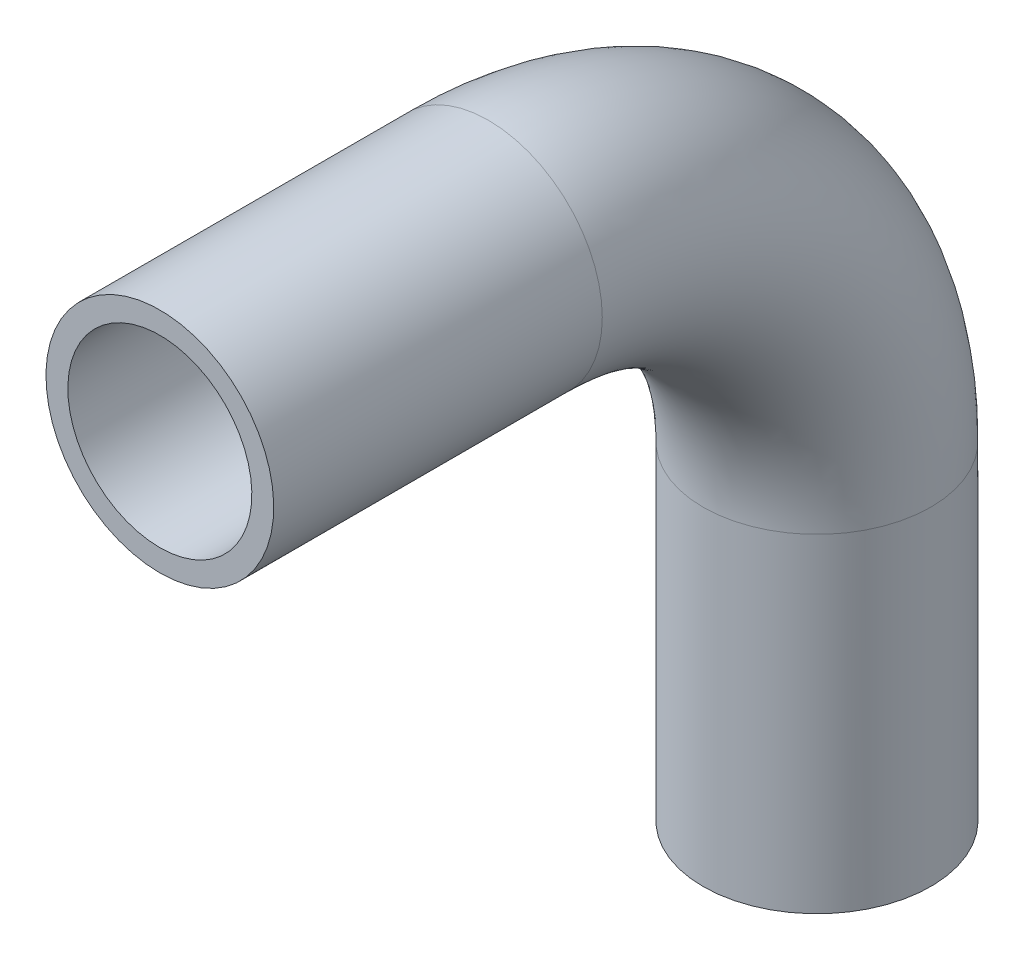
from build123d import *

# Parameters (mm, degrees)
SKETCH2_R   = 6.604
SKETCH2_R_2 = 5.334


with BuildPart() as part:
    # Sweep-Thin1: sweep along a path in Sketch1
    with BuildLine(Plane(origin=(0, 0, 0), x_dir=(0, 0, -1), z_dir=(1, 0, 0))) as sweep_thin1_path:
        Line((0, 0), (0, 19.05))
        ThreePointArc((0, 19.05), (-5.579615818, 32.520384182), (-19.05, 38.1))
        Line((-19.05, 38.1), (-38.1, 38.1))
    # Sketch2 → Sweep-Thin1 (sweep)
    with BuildSketch(Plane(origin=(0, 0, 0), x_dir=(1, 0, 0), z_dir=(0, 1, 0))):
        Circle(SKETCH2_R)
        Circle(SKETCH2_R_2, mode=Mode.SUBTRACT)
    sweep(path=sweep_thin1_path.line)


solid = part.part
